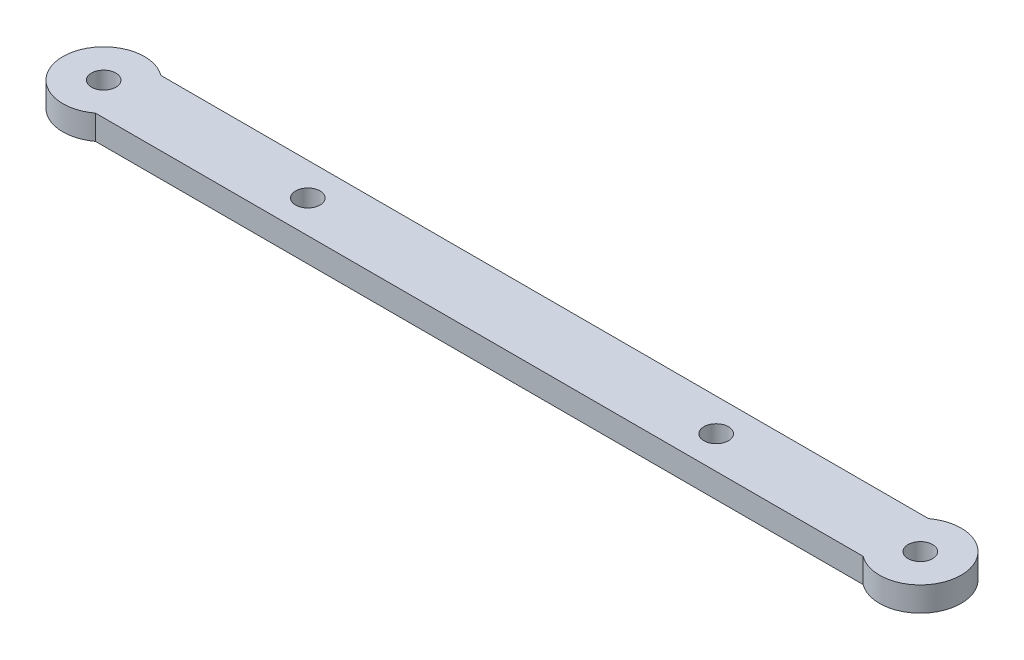
from build123d import *

# Parameters (mm, degrees)
CROQUIS1_R              = 1.5
SALIENTE_EXTRUIR1_DEPTH = 3


with BuildPart() as part:
    # Croquis1 → Saliente-Extruir1 (new body)
    with BuildSketch(Plane(origin=(0, 0, 0), x_dir=(1, 0, 0), z_dir=(0, 1, 0))):
        with BuildLine():
            Line((-47, 4), (47, 4))
            ThreePointArc((47, 4), (55, 0), (47, -4))
            Line((47, -4), (-47, -4))
            ThreePointArc((-47, -4), (-55, 0), (-47, 4))
        make_face()
        with Locations(Location((-50, 0, 0), (0, 0, 270))):
            Circle(CROQUIS1_R, mode=Mode.SUBTRACT)
        with Locations(Location((50, 0, 0), (0, 0, 90))):
            Circle(CROQUIS1_R, mode=Mode.SUBTRACT)
        with Locations(Location((25, 0, 0), (0, 0, 270))):
            Circle(CROQUIS1_R, mode=Mode.SUBTRACT)
        with Locations(Location((-25, 0, 0), (0, 0, 270))):
            Circle(CROQUIS1_R, mode=Mode.SUBTRACT)
    extrude(amount=SALIENTE_EXTRUIR1_DEPTH)


solid = part.part
